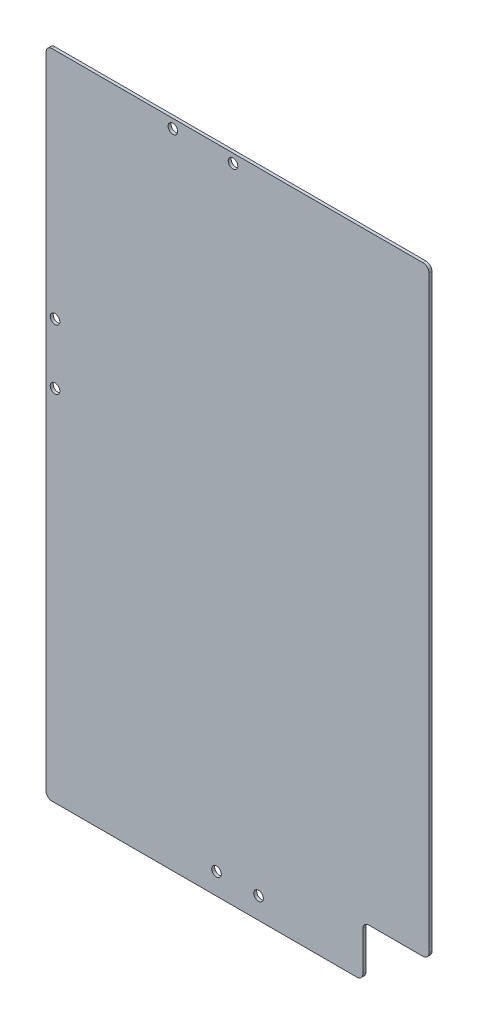
from build123d import *

# Parameters (mm, degrees)
SKETCH_1_W          = 127.5
SKETCH_1_H          = 185
SKETCH_1_R          = 1.6
EXTRUDE_1_DEPTH     = 1
SKETCH_2_W          = 127.5
SKETCH_2_H          = 35
EXTRUDE_2_DEPTH     = 1
SKETCH_3_R          = 1.6
CUT_EXTRUDE_1_DEPTH = 10
SKETCH_4_W          = 127.5
SKETCH_4_H          = 3
CUT_EXTRUDE_2_DEPTH = 10
SKETCH_5_W          = 22
SKETCH_5_H          = 17
CUT_EXTRUDE_3_DEPTH = 10
FILLET_2_R          = 2


with BuildPart() as part:
    # 草图1 → 凸台-拉伸1 (new body)
    with BuildSketch(Plane.XY):
        Rectangle(SKETCH_1_W, SKETCH_1_H)
        with Locations((-21.5, 89.5)):
            Circle(SKETCH_1_R, mode=Mode.SUBTRACT)
        with Locations((-1.5, 89.5)):
            Circle(SKETCH_1_R, mode=Mode.SUBTRACT)
        with Locations((-60.75, 15)):
            Circle(SKETCH_1_R, mode=Mode.SUBTRACT)
        with Locations((-60.75, -5)):
            Circle(SKETCH_1_R, mode=Mode.SUBTRACT)
    extrude(amount=EXTRUDE_1_DEPTH)

    # 草图2 → 凸台-拉伸2 (add)
    with BuildSketch(Plane.XY.offset(1)):
        with Locations((0, -110)):
            Rectangle(SKETCH_2_W, SKETCH_2_H)
    extrude(amount=-EXTRUDE_2_DEPTH)

    # 草图3 → 切除-拉伸1 (cut)
    with BuildSketch(Plane(origin=(0, 0, 0), x_dir=(-1, 0, 0), z_dir=(0, 0, -1))):
        with Locations((-7, -117.4)):
            Circle(SKETCH_3_R)
        with Locations((7, -117.4)):
            Circle(SKETCH_3_R)
    extrude(amount=-CUT_EXTRUDE_1_DEPTH, mode=Mode.SUBTRACT)

    # 草图4 → 切除-拉伸2 (cut)
    with BuildSketch(Plane(origin=(0, 0, 0), x_dir=(-1, 0, 0), z_dir=(0, 0, -1))):
        with Locations((0, -126)):
            Rectangle(SKETCH_4_W, SKETCH_4_H)
    extrude(amount=-CUT_EXTRUDE_2_DEPTH, mode=Mode.SUBTRACT)

    # 草图5 → 切除-拉伸3 (cut)
    with BuildSketch(Plane.XY.offset(1)):
        with Locations((52.75, -116)):
            Rectangle(SKETCH_5_W, SKETCH_5_H)
    extrude(amount=-CUT_EXTRUDE_3_DEPTH, mode=Mode.SUBTRACT)

    # 圆角2
    fillet_2_edges = [part.edges().sort_by_distance(p)[0] for p in [
        (-63.75, -124.5, 0.5),
        (41.75, -124.5, 0.5),
        (-63.75, 92.5, 0.5),
        (63.75, 92.5, 0.5),
        (63.75, -107.5, 0.5),
        (41.75, -107.5, 0.5),
    ]]
    fillet(fillet_2_edges, radius=FILLET_2_R)


solid = part.part
